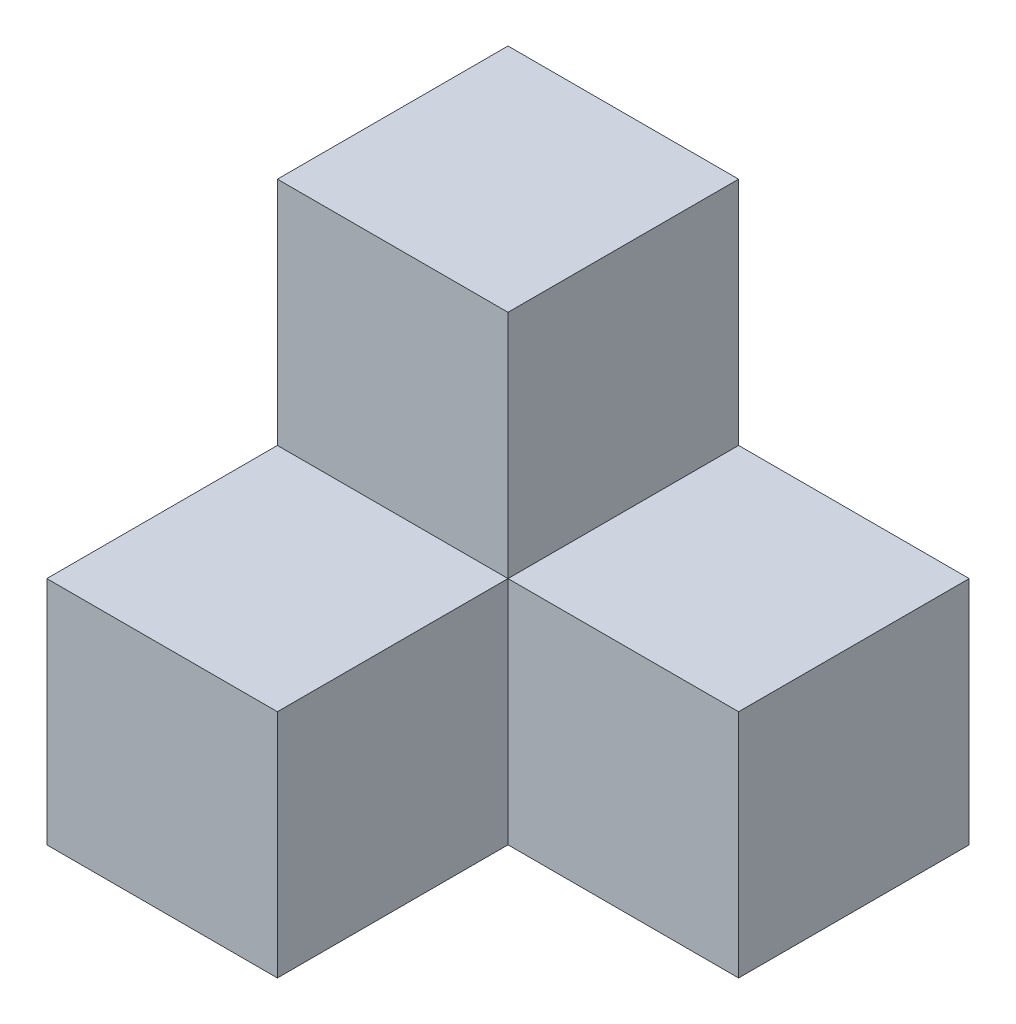
from build123d import *

# Parameters (mm, degrees)
BOSS_EXTRU_1_DEPTH = 10
ESQUISSE2_W        = 10
ESQUISSE2_H        = 10
BOSS_EXTRU_2_DEPTH = 10


with BuildPart() as part:
    # Esquisse1 → Boss.-Extru.1 (new body)
    with BuildSketch(Plane.XY):
        Polygon((0, 0), (0, 20), (10, 20), (10, 10), (20, 10), (20, 0), align=None)
    extrude(amount=BOSS_EXTRU_1_DEPTH)

    # Esquisse2 → Boss.-Extru.2 (add)
    with BuildSketch(Plane.XY.offset(10)):
        with Locations((5, 5)):
            Rectangle(ESQUISSE2_W, ESQUISSE2_H)
    extrude(amount=BOSS_EXTRU_2_DEPTH)


solid = part.part
